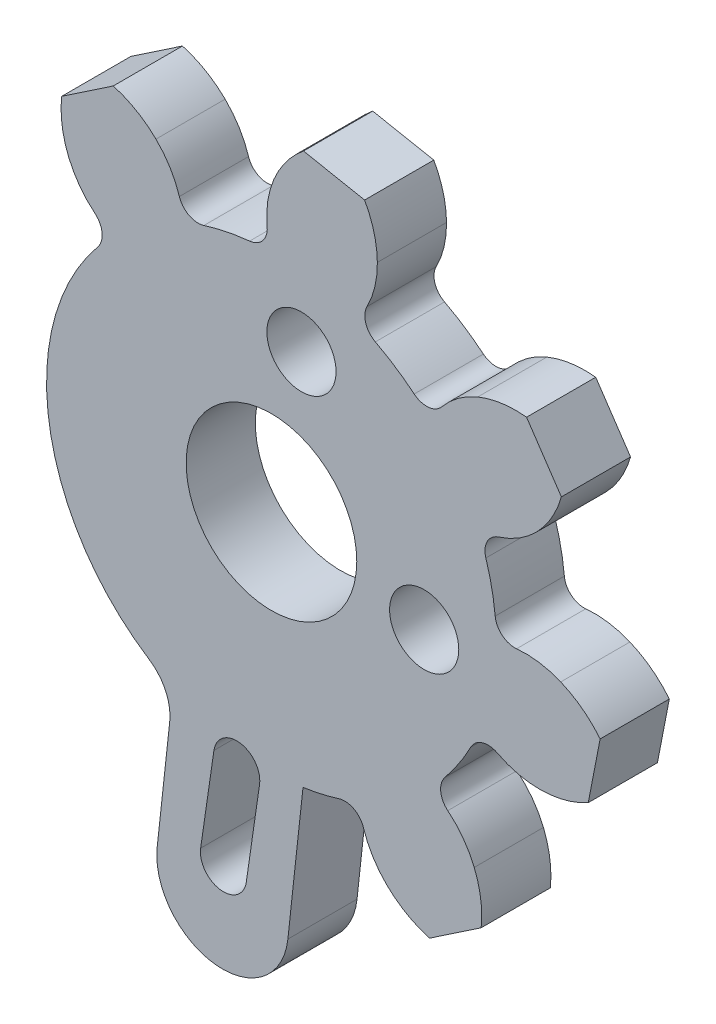
from build123d import *

# Parameters (mm, degrees)
SKETCH1_R           = 1.5
SKETCH1_R_2         = 3.7
BOSS_EXTRUDE1_DEPTH = 3


with BuildPart() as part:
    # Sketch1 → Boss-Extrude1 (new body)
    with BuildSketch(Plane.XY):
        with BuildLine():
            Line((13.740457451, -4.042470891), (14.255332257, -1.392017357))
            ThreePointArc((14.255332257, -1.392017357), (13.480746798, -0.642737861), (12.546028185, -0.106357853))
            ThreePointArc((12.546028185, -0.106357853), (11.607127827, 0.157211053), (10.632288023, 0.1834752))
            ThreePointArc((10.632288023, 0.1834752), (10.010207796, 0.372487454), (9.703996042, 0.94602368))
            ThreePointArc((9.703996042, 0.94602368), (9.553721125, 1.946512948), (9.300578942, 2.926043632))
            ThreePointArc((9.300578942, 2.926043632), (9.357660457, 3.573428685), (9.855662757, 3.990992351))
            ThreePointArc((9.855662757, 3.990992351), (10.742650685, 4.396276035), (11.503786091, 5.005927856))
            ThreePointArc((11.503786091, 5.005927856), (12.154418131, 5.865043883), (12.57442922, 6.85751206))
            Line((12.57442922, 6.85751206), (11.06434702, 9.095737194))
            ThreePointArc((11.06434702, 9.095737194), (9.986811776, 9.077843176), (8.946587965, 8.796175247))
            ThreePointArc((8.946587965, 8.796175247), (8.096313795, 8.318643798), (7.388426402, 7.647899519))
            ThreePointArc((7.388426402, 7.647899519), (6.814897409, 7.341674219), (6.192821647, 7.530701165))
            ThreePointArc((6.192821647, 7.530701165), (5.379108488, 8.131893498), (4.507477145, 8.645527732))
            ThreePointArc((4.507477145, 8.645527732), (4.09006951, 9.14366082), (4.146948213, 9.791063724))
            ThreePointArc((4.146948213, 9.791063724), (4.487564551, 10.704837744), (4.594679622, 11.674130687))
            ThreePointArc((4.594679622, 11.674130687), (4.447259181, 12.741683783), (4.042470891, 13.740457451))
            Line((4.042470891, 13.740457451), (1.392017357, 14.255332257))
            ThreePointArc((1.392017357, 14.255332257), (0.642737861, 13.480746798), (0.106357853, 12.546028185))
            ThreePointArc((0.106357853, 12.546028185), (-0.157211053, 11.607127827), (-0.1834752, 10.632288023))
            ThreePointArc((-0.1834752, 10.632288023), (-0.372487454, 10.010207796), (-0.94602368, 9.703996042))
            ThreePointArc((-0.94602368, 9.703996042), (-1.946512948, 9.553721125), (-2.926043632, 9.300578942))
            ThreePointArc((-2.926043632, 9.300578942), (-3.573428685, 9.357660457), (-3.990992351, 9.855662757))
            ThreePointArc((-3.990992351, 9.855662757), (-4.396276035, 10.742650685), (-5.005927856, 11.503786091))
            ThreePointArc((-5.005927856, 11.503786091), (-5.865043883, 12.154418131), (-6.85751206, 12.57442922))
            Line((-6.85751206, 12.57442922), (-9.095737194, 11.06434702))
            ThreePointArc((-9.095737194, 11.06434702), (-9.077843176, 9.986811776), (-8.796175247, 8.946587965))
            ThreePointArc((-8.796175247, 8.946587965), (-8.318643798, 8.096313795), (-7.647899519, 7.388426402))
            ThreePointArc((-7.647899519, 7.388426402), (-7.341674219, 6.814897409), (-7.530701165, 6.192821647))
            ThreePointArc((-7.530701165, 6.192821647), (-9.635448804, -1.490176611), (-5.308108038, -8.178416047))
            ThreePointArc((-5.308108038, -8.178416047), (-4.590564776, -8.998081228), (-4.409043882, -10.072217861))
            Line((-4.409043882, -10.072217861), (-4.952379844, -15.064191543))
            ThreePointArc((-4.952379844, -15.064191543), (-2.426769985, -18.205915305), (0.714311062, -15.679506151))
            Line((0.714311062, -15.679506151), (1.370494976, -9.653198615))
            ThreePointArc((1.370494976, -9.653198615), (2.155492092, -9.508751433), (2.926043632, -9.300578942))
            ThreePointArc((2.926043632, -9.300578942), (3.573428685, -9.357660457), (3.990992351, -9.855662757))
            ThreePointArc((3.990992351, -9.855662757), (4.396276035, -10.742650685), (5.005927856, -11.503786091))
            ThreePointArc((5.005927856, -11.503786091), (5.865043883, -12.154418131), (6.85751206, -12.57442922))
            Line((6.85751206, -12.57442922), (9.095737194, -11.06434702))
            ThreePointArc((9.095737194, -11.06434702), (9.077843176, -9.986811776), (8.796175247, -8.946587965))
            ThreePointArc((8.796175247, -8.946587965), (8.318643798, -8.096313795), (7.647899519, -7.388426402))
            ThreePointArc((7.647899519, -7.388426402), (7.341674219, -6.814897409), (7.530701165, -6.192821647))
            ThreePointArc((7.530701165, -6.192821647), (8.131893498, -5.379108488), (8.645527732, -4.507477145))
            ThreePointArc((8.645527732, -4.507477145), (9.14366082, -4.09006951), (9.791063724, -4.146948213))
            ThreePointArc((9.791063724, -4.146948213), (10.704837744, -4.487564551), (11.674130687, -4.594679622))
            ThreePointArc((11.674130687, -4.594679622), (12.741683783, -4.447259181), (13.740457451, -4.042470891))
        make_face()
        with Locations((6.625050503, -1.101923166)):
            Circle(SKETCH1_R, mode=Mode.SUBTRACT)
        with Locations((0.002221487, -0.000323095)):
            Circle(SKETCH1_R_2, mode=Mode.SUBTRACT)
        with Locations((1.303084957, 6.668993396)):
            Circle(SKETCH1_R, mode=Mode.SUBTRACT)
        with BuildLine():
            Line((-3.068510764, -14.155643998), (-2.492411625, -10.197347675))
            ThreePointArc((-2.492411625, -10.197347675), (-1.35881276, -9.351798379), (-0.513263464, -10.485397245))
            Line((-0.513263464, -10.485397245), (-1.089362603, -14.443693568))
            ThreePointArc((-1.089362603, -14.443693568), (-2.222961468, -15.289242864), (-3.068510764, -14.155643998))
        make_face(mode=Mode.SUBTRACT)
    extrude(amount=BOSS_EXTRUDE1_DEPTH)


solid = part.part
